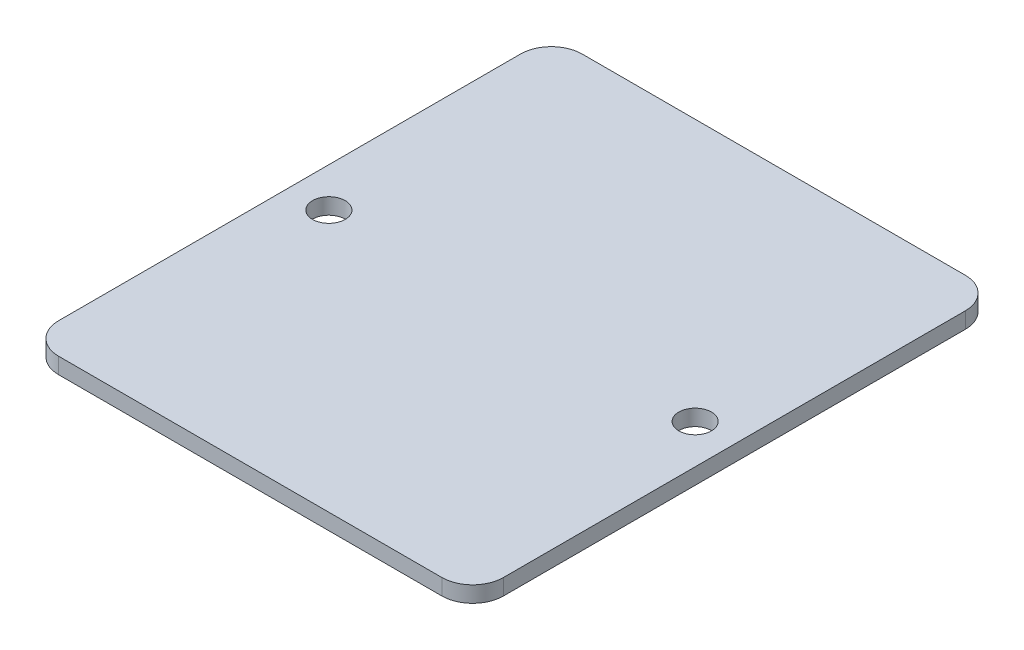
from build123d import *

# Parameters (mm, degrees)
SKETCH1_W           = 43.25
SKETCH1_H           = 50.9
BOSS_EXTRUDE1_DEPTH = 1.56
FILLET1_R           = 3
FILLET2_R           = 3
SKETCH2_R           = 1.5875
CUT_EXTRUDE1_DEPTH  = 1.56


with BuildPart() as part:
    # Sketch1 → Boss-Extrude1 (new body)
    with BuildSketch(Plane(origin=(0, 0, 0), x_dir=(1, 0, 0), z_dir=(0, 1, 0))):
        Rectangle(SKETCH1_W, SKETCH1_H)
    extrude(amount=BOSS_EXTRUDE1_DEPTH)

    # Fillet1
    fillet1_edges = [part.edges().sort_by_distance(p)[0] for p in [
        (21.625, 0.78, 25.45),
    ]]
    fillet(fillet1_edges, radius=FILLET1_R)

    # Fillet2
    fillet2_edges = [part.edges().sort_by_distance(p)[0] for p in [
        (-21.625, 0.78, -25.45),
        (21.625, 0.78, -25.45),
        (-21.625, 0.78, 25.45),
    ]]
    fillet(fillet2_edges, radius=FILLET2_R)

    # Sketch2 → Cut-Extrude1 (cut)
    with BuildSketch(Plane(origin=(0, 1.56, 0), x_dir=(1, 0, 0), z_dir=(0, 1, 0))):
        with Locations(Location((-17.805, 0, 0), (0, 0, 270))):
            Circle(SKETCH2_R)
        with Locations(Location((17.805, 0, 0), (0, 0, 270))):
            Circle(SKETCH2_R)
    extrude(amount=-CUT_EXTRUDE1_DEPTH, mode=Mode.SUBTRACT)


solid = part.part
